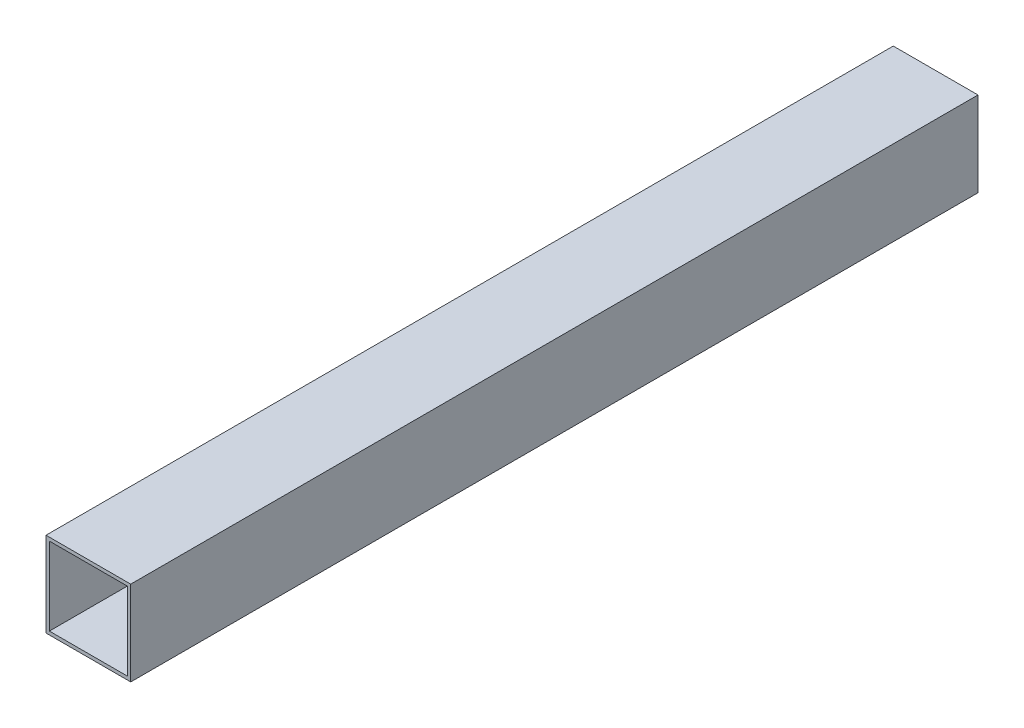
from build123d import *

# Parameters (mm, degrees)
CROQUIS1_W              = 100
CROQUIS1_H              = 100
CROQUIS1_W_2            = 92
CROQUIS1_H_2            = 92
SALIENTE_EXTRUIR1_DEPTH = 1000


with BuildPart() as part:
    # Croquis1 → Saliente-Extruir1 (new body)
    with BuildSketch(Plane.XY):
        with Locations((-57.863012306, -18.62925801)):
            Rectangle(CROQUIS1_W, CROQUIS1_H)
        with Locations((-57.863012306, -18.62925801)):
            Rectangle(CROQUIS1_W_2, CROQUIS1_H_2, mode=Mode.SUBTRACT)
    extrude(amount=SALIENTE_EXTRUIR1_DEPTH)


solid = part.part
